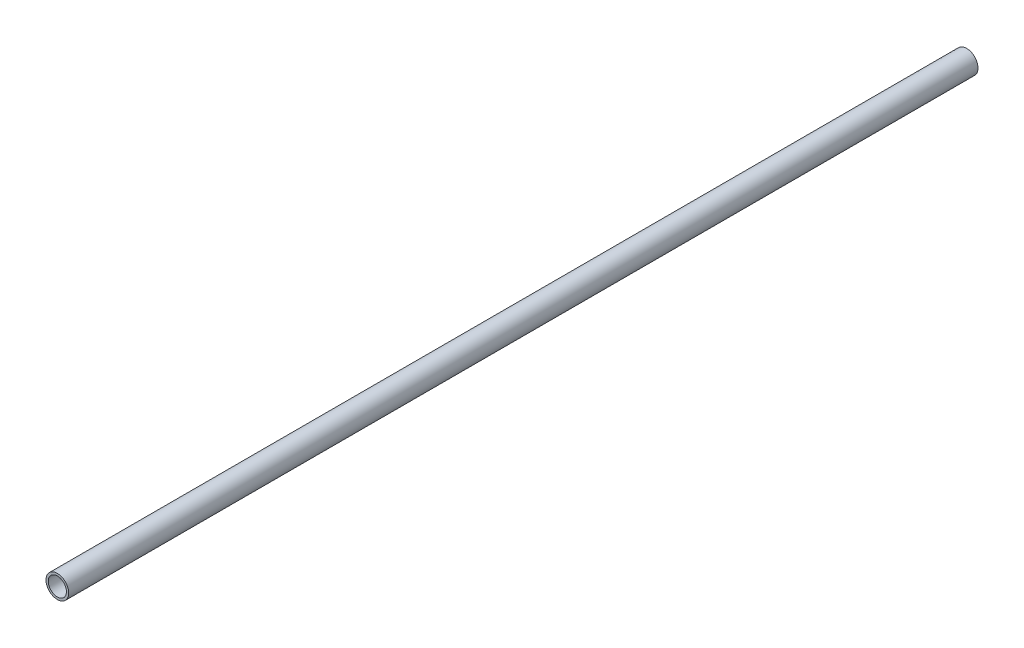
from build123d import *

# Parameters (mm, degrees)
SKETCH_1_R      = 5
SKETCH_1_R_2    = 4
EXTRUDE_1_DEPTH = 400


with BuildPart() as part:
    # ｽｹｯﾁ1 → ﾎﾞｽ - 押し出し1 (new body)
    with BuildSketch(Plane.XY):
        Circle(SKETCH_1_R)
        Circle(SKETCH_1_R_2, mode=Mode.SUBTRACT)
    extrude(amount=EXTRUDE_1_DEPTH)


solid = part.part
